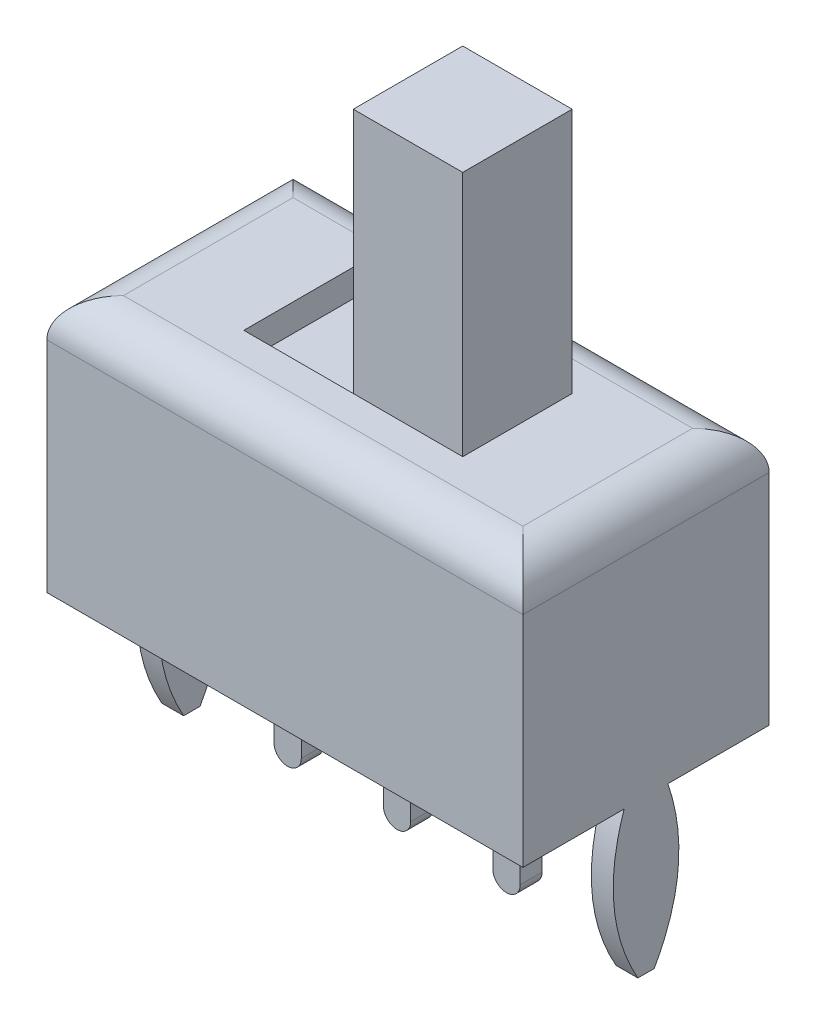
from build123d import *

# Parameters (mm, degrees)
SKETCH1_W           = 8.7
SKETCH1_H           = 4.7
BOSS_EXTRUDE1_DEPTH = 2.25
FILLET1_R           = 0.7
BOSS_EXTRUDE2_DEPTH = 0.4
BOSS_EXTRUDE3_DEPTH = 0.2
SKETCH6_W           = 4
SKETCH6_H           = 2
CUT_EXTRUDE1_DEPTH  = 0.5
SKETCH7_W           = 2
SKETCH7_H           = 2
BOSS_EXTRUDE4_DEPTH = 5


with BuildPart() as part:
    # Sketch1 → Boss-Extrude1 (new, symmetric)
    with BuildSketch(Plane.XY):
        Rectangle(SKETCH1_W, SKETCH1_H)
    extrude(amount=BOSS_EXTRUDE1_DEPTH, both=True)

    # Fillet1
    fillet1_edges = [part.edges().sort_by_distance(p)[0] for p in [
        (0, 2.35, -2.25),
        (0, 2.35, 2.25),
        (-4.35, 2.35, 0),
        (4.35, 2.35, 0),
    ]]
    fillet(fillet1_edges, radius=FILLET1_R)

    # Sketch3 → Boss-Extrude2 (add)
    with BuildSketch(Plane.ZY.offset(4.35)):
        with BuildLine():
            Line((-0.15, -5.15), (0.15, -5.15))
            add(Edge.make_bspline(
                [(0.4, -2.35), (0.9, -3.820089362), (0.15, -5.15)],
                knots=[0, 0, 0, 1, 1, 1], degree=2))
            Line((0.4, -2.35), (-0.4, -2.35))
            add(Edge.make_bspline(
                [(-0.4, -2.35), (-0.9, -3.820089362), (-0.15, -5.15)],
                knots=[0, 0, 0, 1, 1, 1], degree=2))
        make_face()
    boss_extrude2 = extrude(amount=-BOSS_EXTRUDE2_DEPTH)

    # Mirror1: Boss-Extrude2 across plane
    add(boss_extrude2.mirror(Plane(origin=(0, 0, 0), x_dir=(0, 0, 1), z_dir=(1, 0, 0))))

    # Sketch5 → Boss-Extrude3 (add, symmetric)
    with BuildSketch(Plane.XY):
        with BuildLine():
            Line((-0.25, -2.35), (0.25, -2.35))
            Line((0.25, -2.35), (0.25, -4.7))
            ThreePointArc((0.25, -4.7), (0, -4.95), (-0.25, -4.7))
            Line((-0.25, -4.7), (-0.25, -2.35))
        make_face()
        with BuildLine():
            Line((1.75, -2.35), (2.25, -2.35))
            Line((2.25, -2.35), (2.25, -4.7))
            ThreePointArc((2.25, -4.7), (2, -4.95), (1.75, -4.7))
            Line((1.75, -4.7), (1.75, -2.35))
        make_face()
        with BuildLine():
            Line((-1.75, -2.35), (-1.75, -4.7))
            ThreePointArc((-1.75, -4.7), (-2, -4.95), (-2.25, -4.7))
            Line((-2.25, -4.7), (-2.25, -2.35))
            Line((-2.25, -2.35), (-1.75, -2.35))
        make_face()
    extrude(amount=BOSS_EXTRUDE3_DEPTH, both=True)

    # Sketch6 → Cut-Extrude1 (cut)
    with BuildSketch(Plane(origin=(0, 2.35, 0), x_dir=(1, 0, 0), z_dir=(0, 1, 0))):
        Rectangle(SKETCH6_W, SKETCH6_H)
    extrude(amount=-CUT_EXTRUDE1_DEPTH, mode=Mode.SUBTRACT)

    # Sketch7 → Boss-Extrude4 (add)
    with BuildSketch(Plane(origin=(0, 1.85, 0), x_dir=(1, 0, 0), z_dir=(0, 1, 0))):
        with Locations((1, 0)):
            Rectangle(SKETCH7_W, SKETCH7_H)
    extrude(amount=BOSS_EXTRUDE4_DEPTH)


solid = part.part
